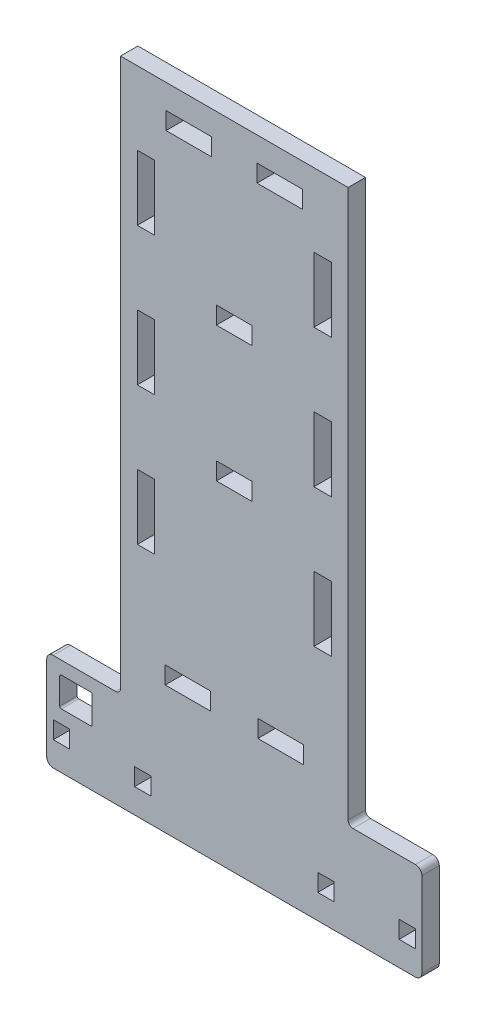
from build123d import *

# Parameters (mm, degrees)
MODEL_W             = 5
MODEL_H             = 5.35
MODEL_W_2           = 14
MODEL_W_3           = 11
MODEL_W_4           = 5.35
MODEL_H_2           = 20
BOSS_EXTRUDE1_DEPTH = 5.35


with BuildPart() as part:
    # Model → Boss-Extrude1 (new body)
    with BuildSketch(Plane.XY):
        with BuildLine():
            Line((-55.695, 30), (-36.5, 30))
            ThreePointArc((-36.5, 30), (-35.439339828, 30.439339828), (-35, 31.5))
            Line((-35, 31.5), (-35, 200))
            Line((-35, 200), (35, 200))
            Line((35, 200), (35, 31.5))
            ThreePointArc((35, 31.5), (35.439339828, 30.439339828), (36.5, 30))
            Line((36.5, 30), (55.695, 30))
            ThreePointArc((55.695, 30), (57.109213562, 29.414213562), (57.695, 28))
            Line((57.695, 28), (57.695, 2))
            ThreePointArc((57.695, 2), (57.109213562, 0.585786438), (55.695, 0))
            Line((55.695, 0), (-55.695, 0))
            ThreePointArc((-55.695, 0), (-57.109213562, 0.585786438), (-57.695, 2))
            Line((-57.695, 2), (-57.695, 28))
            ThreePointArc((-57.695, 28), (-57.109213562, 29.414213562), (-55.695, 30))
        make_face()
        with Locations((53.175, 10.225)):
            Rectangle(MODEL_W, MODEL_H, mode=Mode.SUBTRACT)
        with Locations((-53.175, 10.225)):
            Rectangle(MODEL_W, MODEL_H, mode=Mode.SUBTRACT)
        with Locations((14.25, 42.025)):
            Rectangle(MODEL_W_2, MODEL_H, mode=Mode.SUBTRACT)
        with Locations((0, 145.75)):
            Rectangle(MODEL_W_3, MODEL_H, mode=Mode.SUBTRACT)
        with Locations((0, 104.25)):
            Rectangle(MODEL_W_3, MODEL_H, mode=Mode.SUBTRACT)
        with Locations((-14, 189.825)):
            Rectangle(MODEL_W_2, MODEL_H, mode=Mode.SUBTRACT)
        with Locations((-27.155, 167.5)):
            Rectangle(MODEL_W_4, MODEL_H_2, mode=Mode.SUBTRACT)
        with Locations((-27.155, 125)):
            Rectangle(MODEL_W_4, MODEL_H_2, mode=Mode.SUBTRACT)
        with Locations((-27.155, 82.5)):
            Rectangle(MODEL_W_4, MODEL_H_2, mode=Mode.SUBTRACT)
        with Locations((-14.25, 42.025)):
            Rectangle(MODEL_W_2, MODEL_H, mode=Mode.SUBTRACT)
        with Locations((27.155, 82.5)):
            Rectangle(MODEL_W_4, MODEL_H_2, mode=Mode.SUBTRACT)
        with Locations((27.155, 125)):
            Rectangle(MODEL_W_4, MODEL_H_2, mode=Mode.SUBTRACT)
        with Locations((27.155, 167.5)):
            Rectangle(MODEL_W_4, MODEL_H_2, mode=Mode.SUBTRACT)
        with Locations((14, 189.825)):
            Rectangle(MODEL_W_2, MODEL_H, mode=Mode.SUBTRACT)
        with Locations((-28.175, 10.225)):
            Rectangle(MODEL_W, MODEL_H, mode=Mode.SUBTRACT)
        with BuildLine():
            Line((-53.195, 26), (-44.195, 26))
            ThreePointArc((-44.195, 26), (-43.841446609, 25.853553391), (-43.695, 25.5))
            Line((-43.695, 25.5), (-43.695, 17.5))
            ThreePointArc((-43.695, 17.5), (-43.841446609, 17.146446609), (-44.195, 17))
            Line((-44.195, 17), (-53.195, 17))
            ThreePointArc((-53.195, 17), (-53.548553391, 17.146446609), (-53.695, 17.5))
            Line((-53.695, 17.5), (-53.695, 25.5))
            ThreePointArc((-53.695, 25.5), (-53.548553391, 25.853553391), (-53.195, 26))
        make_face(mode=Mode.SUBTRACT)
        with Locations((28.175, 10.225)):
            Rectangle(MODEL_W, MODEL_H, mode=Mode.SUBTRACT)
    extrude(amount=BOSS_EXTRUDE1_DEPTH)


solid = part.part
